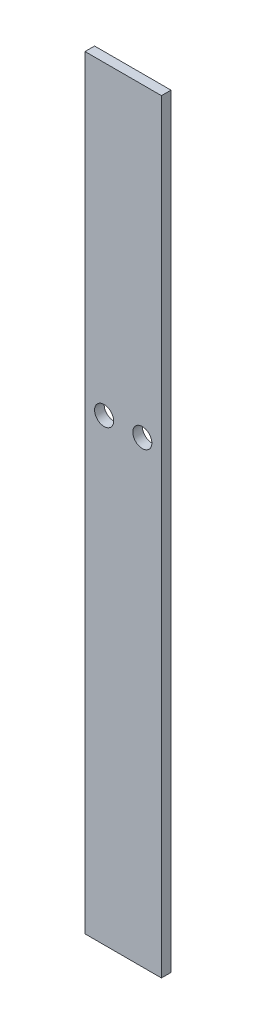
from build123d import *

# Parameters (mm, degrees)
SKETCH1_W           = 38.1
SKETCH1_H           = 381
SKETCH1_R           = 4.7625
BOSS_EXTRUDE1_DEPTH = 4.7625


with BuildPart() as part:
    # Sketch1 → Boss-Extrude1 (new body)
    with BuildSketch(Plane.XY):
        with Locations((19.05, 190.5)):
            Rectangle(SKETCH1_W, SKETCH1_H)
        with Locations(Location((9.525, 228.6, 0), (0, 0, 180))):
            Circle(SKETCH1_R, mode=Mode.SUBTRACT)
        with Locations(Location((28.575, 228.6, 0), (0, 0, 180))):
            Circle(SKETCH1_R, mode=Mode.SUBTRACT)
    extrude(amount=BOSS_EXTRUDE1_DEPTH)


solid = part.part
